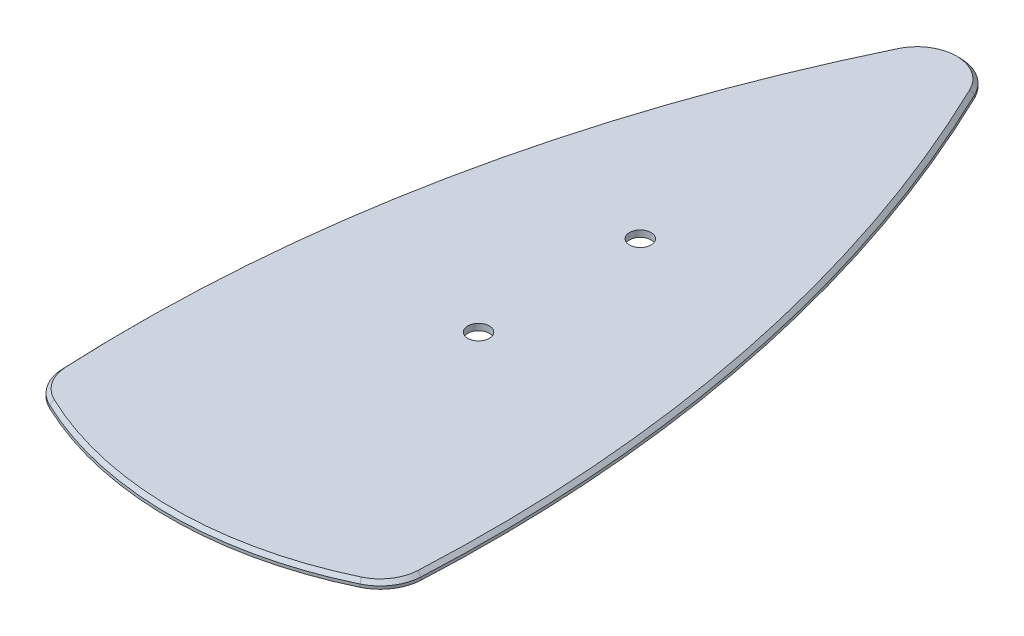
from build123d import *

# Parameters (mm, degrees)
BOSS_EXTRUDE1_DEPTH = 9
CHAMFER1_SIZE       = 5
SKETCH2_R           = 15
CUT_EXTRUDE1_DEPTH  = 606.180442557


with BuildPart() as part:
    # Sketch1 → Boss-Extrude1 (new body)
    with BuildSketch(Plane(origin=(0, 0, 0), x_dir=(1, 0, 0), z_dir=(0, 1, 0))):
        with BuildLine():
            ThreePointArc((-54.052143505, 516.045456082), (0, 550), (54.052143505, 516.045456082))
            ThreePointArc((54.052143505, 516.045456082), (212.411110101, 45.380156813), (249.928432165, -449.792375526))
            ThreePointArc((249.928432165, -449.792375526), (239.970710869, -480.073057321), (215.909090909, -500.980337113))
            ThreePointArc((215.909090909, -500.980337113), (0, -550), (-215.909090909, -500.980337113))
            ThreePointArc((-215.909090909, -500.980337113), (-239.970710869, -480.073057321), (-249.928432165, -449.792375526))
            ThreePointArc((-249.928432165, -449.792375526), (-212.411110101, 45.380156813), (-54.052143505, 516.045456082))
        make_face()
    extrude(amount=-BOSS_EXTRUDE1_DEPTH)

    # Chamfer1
    chamfer1_edges = [part.edges().sort_by_distance(p)[0] for p in [
        (0, 0, -550),
        (212.411110101, 0, -45.380156813),
        (239.970710869, 0, 480.073057321),
        (0, 0, 550),
        (-239.970710869, 0, 480.073057321),
        (-212.411110101, 0, -45.380156813),
    ]]
    chamfer(chamfer1_edges, length=CHAMFER1_SIZE)

    # Sketch2 → Cut-Extrude1 (cut, through all)
    with BuildSketch(Plane(origin=(0, 0, 0), x_dir=(1, 0, 0), z_dir=(0, 1, 0))):
        with Locations(Location((0, 105, 0), (0, 0, 270))):
            Circle(SKETCH2_R)
        with Locations(Location((0, -120, 0), (0, 0, 270))):
            Circle(SKETCH2_R)
    extrude(amount=-CUT_EXTRUDE1_DEPTH, mode=Mode.SUBTRACT)


solid = part.part
